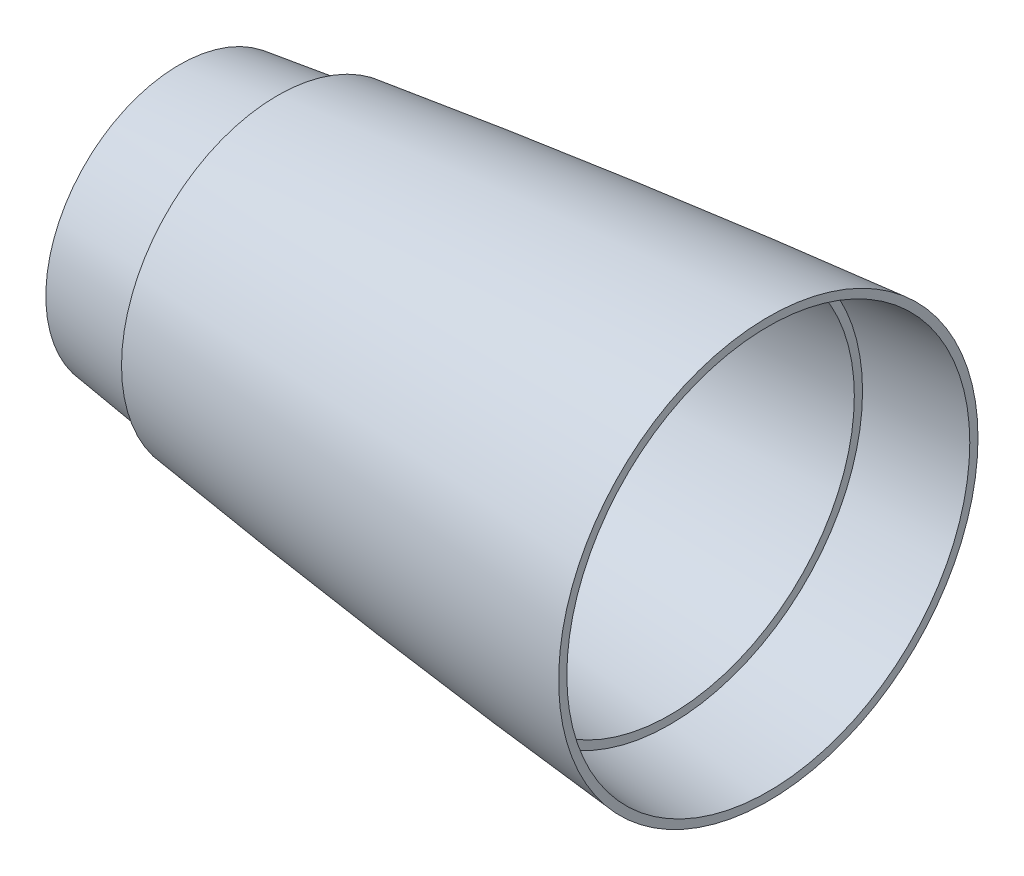
from build123d import *


with BuildPart() as part:
    # Sketch1 → Revolve1 (revolve)
    with BuildSketch(Plane.XY, mode=Mode.PRIVATE) as revolve1_sk:
        with BuildLine():
            Line((-320, 3618.879522725), (-320, 3621.389270708))
            ThreePointArc((-320, 3621.389270708), (-395.085086609, 3613.968459234), (-470, 3604.991019406))
            Line((-470, 3604.991019406), (-470, 3602.469847202))
            Line((-470, 3602.469847202), (-470, 3602.167304554))
            ThreePointArc((-470, 3602.167304554), (-485.004209708, 3600.177802077), (-499.999999999, 3598.125802414))
            Line((-499.999999999, 3598.125802414), (-499.999999999, 3595.904649737))
            ThreePointArc((-499.999999999, 3595.904649737), (-425.091978188, 3605.527292932), (-350, 3613.589662649))
            Line((-350, 3613.589662649), (-350, 3615.799951601))
            Line((-350, 3615.799951601), (-350, 3616.101353668))
            ThreePointArc((-350, 3616.101353668), (-335.002879921, 3617.52153697), (-320, 3618.879522725))
        make_face()
    revolve(revolve1_sk.sketch.rotate(Axis((0, 3557.296761587, 0), (-1, 0, 0)), 90), axis=Axis((0, 3557.296761587, 0), (-1, 0, 0)))


solid = part.part
